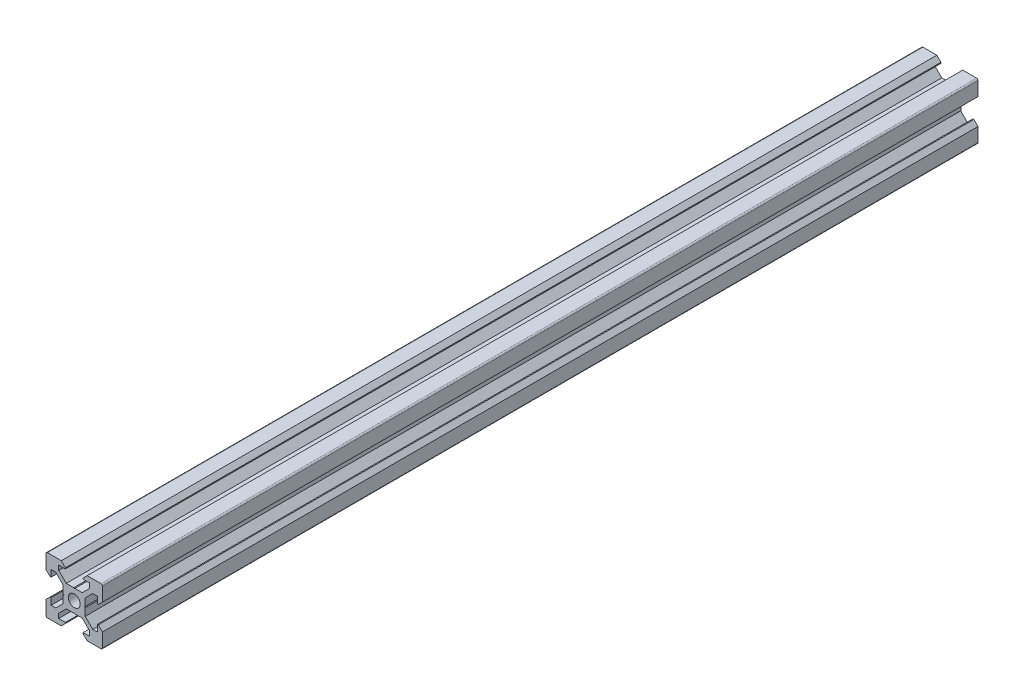
from build123d import *

# Parameters (mm, degrees)
SKETCH1_R           = 2.1
BOSS_EXTRUDE1_DEPTH = 500
SKETCH2_W           = 54.342880418
SKETCH2_H           = 45.441204662
CUT_EXTRUDE1_DEPTH  = 189.7888


with BuildPart() as part:
    # Sketch1 → Boss-Extrude1 (new body)
    with BuildSketch(Plane.XY):
        with BuildLine():
            Line((4.58, -10), (9.5, -10))
            ThreePointArc((9.5, -10), (9.853553391, -9.853553391), (10, -9.5))
            Line((10, -9.5), (10, -4.58))
            Line((10, -4.58), (8.545, -3.125))
            Line((8.545, -3.125), (8.2, -3.125))
            Line((8.2, -3.125), (8.2, -5.5))
            Line((8.2, -5.5), (6.560660172, -5.5))
            Line((6.560660172, -5.5), (3.9, -2.839339828))
            Line((3.9, -2.839339828), (3.9, -0.21))
            Line((3.9, -0.21), (3.69, 0))
            Line((3.69, 0), (3.9, 0.21))
            Line((3.9, 0.21), (3.9, 2.839339828))
            Line((3.9, 2.839339828), (6.560660172, 5.5))
            Line((6.560660172, 5.5), (8.2, 5.5))
            Line((8.2, 5.5), (8.2, 3.125))
            Line((8.2, 3.125), (8.545, 3.125))
            Line((8.545, 3.125), (10, 4.58))
            Line((10, 4.58), (10, 9.5))
            ThreePointArc((10, 9.5), (9.853553391, 9.853553391), (9.5, 10))
            Line((9.5, 10), (4.58, 10))
            Line((4.58, 10), (3.125, 8.545))
            Line((3.125, 8.545), (3.125, 8.2))
            Line((3.125, 8.2), (5.5, 8.2))
            Line((5.5, 8.2), (5.5, 6.560660172))
            Line((5.5, 6.560660172), (2.839339828, 3.9))
            Line((2.839339828, 3.9), (0.21, 3.9))
            Line((0.21, 3.9), (0, 3.69))
            Line((0, 3.69), (-0.21, 3.9))
            Line((-0.21, 3.9), (-2.839339828, 3.9))
            Line((-2.839339828, 3.9), (-5.5, 6.560660172))
            Line((-5.5, 6.560660172), (-5.5, 8.2))
            Line((-5.5, 8.2), (-3.125, 8.2))
            Line((-3.125, 8.2), (-3.125, 8.545))
            Line((-3.125, 8.545), (-4.58, 10))
            Line((-4.58, 10), (-9.5, 10))
            ThreePointArc((-9.5, 10), (-9.853553391, 9.853553391), (-10, 9.5))
            Line((-10, 9.5), (-10, 4.58))
            Line((-10, 4.58), (-8.545, 3.125))
            Line((-8.545, 3.125), (-8.2, 3.125))
            Line((-8.2, 3.125), (-8.2, 5.5))
            Line((-8.2, 5.5), (-6.560660172, 5.5))
            Line((-6.560660172, 5.5), (-3.9, 2.839339828))
            Line((-3.9, 2.839339828), (-3.9, 0.21))
            Line((-3.9, 0.21), (-3.69, 0))
            Line((-3.69, 0), (-3.9, -0.21))
            Line((-3.9, -0.21), (-3.9, -2.839339828))
            Line((-3.9, -2.839339828), (-6.560660172, -5.5))
            Line((-6.560660172, -5.5), (-8.2, -5.5))
            Line((-8.2, -5.5), (-8.2, -3.125))
            Line((-8.2, -3.125), (-8.545, -3.125))
            Line((-8.545, -3.125), (-10, -4.58))
            Line((-10, -4.58), (-10, -9.5))
            ThreePointArc((-10, -9.5), (-9.853553391, -9.853553391), (-9.5, -10))
            Line((-9.5, -10), (-4.58, -10))
            Line((-4.58, -10), (-3.125, -8.545))
            Line((-3.125, -8.545), (-3.125, -8.2))
            Line((-3.125, -8.2), (-5.5, -8.2))
            Line((-5.5, -8.2), (-5.5, -6.560660172))
            Line((-5.5, -6.560660172), (-2.839339828, -3.9))
            Line((-2.839339828, -3.9), (-0.21, -3.9))
            Line((-0.21, -3.9), (0, -3.69))
            Line((0, -3.69), (0.21, -3.9))
            Line((0.21, -3.9), (2.839339828, -3.9))
            Line((2.839339828, -3.9), (5.5, -6.560660172))
            Line((5.5, -6.560660172), (5.5, -8.2))
            Line((5.5, -8.2), (3.125, -8.2))
            Line((3.125, -8.2), (3.125, -8.545))
            Line((3.125, -8.545), (4.58, -10))
        make_face()
        Circle(SKETCH1_R, mode=Mode.SUBTRACT)
    extrude(amount=BOSS_EXTRUDE1_DEPTH)

    # Sketch2 → Cut-Extrude1 (cut)
    with BuildSketch(Plane.XY.offset(500)):
        with Locations((-1.398235928, -4.31119066)):
            Rectangle(SKETCH2_W, SKETCH2_H)
    extrude(amount=-CUT_EXTRUDE1_DEPTH, mode=Mode.SUBTRACT)


solid = part.part
